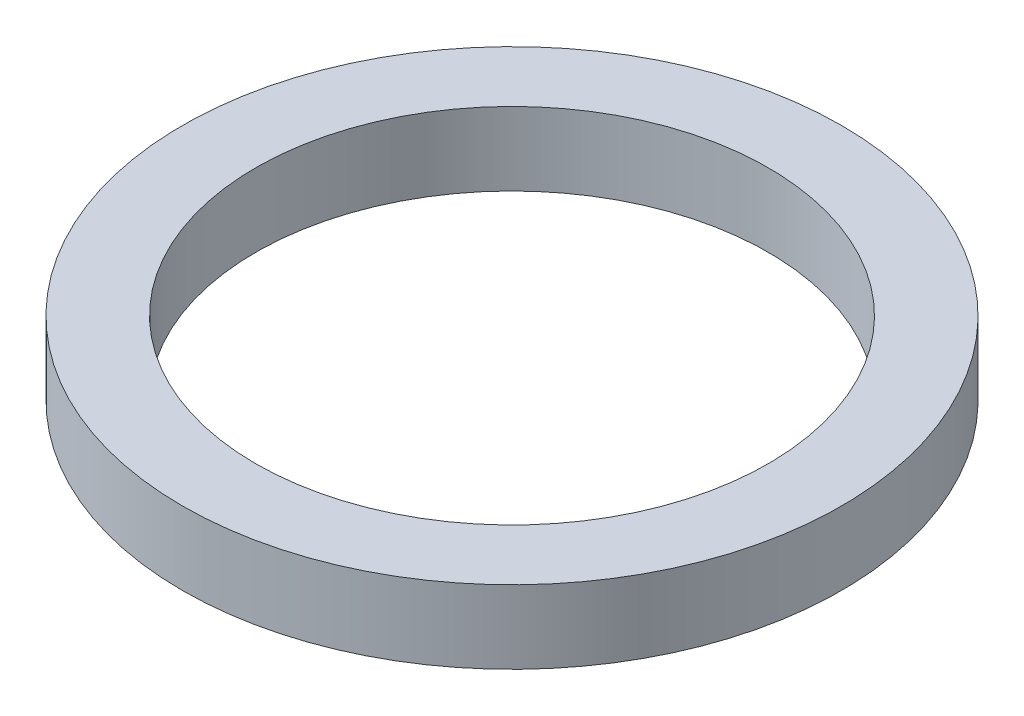
from build123d import *

# Parameters (mm, degrees)
SKETCH1_R           = 45
SKETCH1_R_2         = 35
BOSS_EXTRUDE1_DEPTH = 10


with BuildPart() as part:
    # Sketch1 → Boss-Extrude1 (new body)
    with BuildSketch(Plane(origin=(0, 0, 0), x_dir=(1, 0, 0), z_dir=(0, 1, 0))):
        with Locations(Location((0, 0, 0), (0, 0, 270))):
            Circle(SKETCH1_R)
        with Locations(Location((0, 0, 0), (0, 0, 270))):
            Circle(SKETCH1_R_2, mode=Mode.SUBTRACT)
    extrude(amount=BOSS_EXTRUDE1_DEPTH)


solid = part.part
